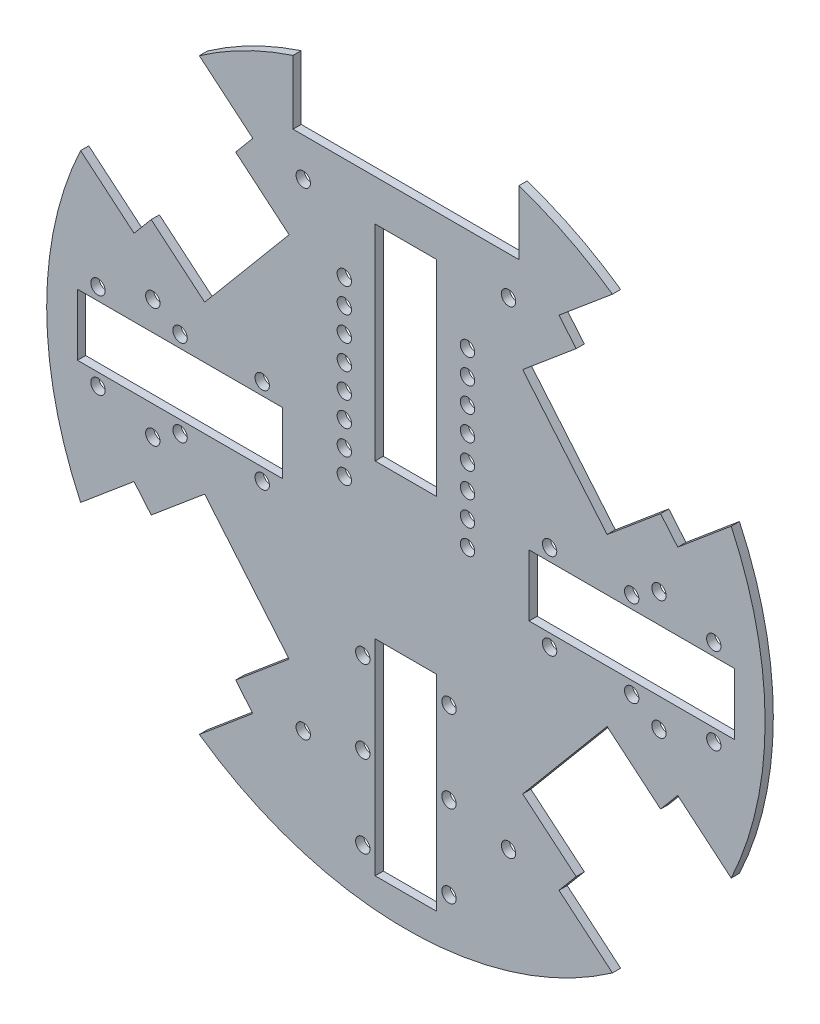
from build123d import *

# Parameters (mm, degrees)
SKETCH2_R                                  = 87.5
BOSS_EXTRUDE2_DEPTH                        = 2
SKETCH3_W                                  = 55
SKETCH3_H                                  = 40
CUT_EXTRUDE1_DEPTH                         = 124.759848093
CUT_EXTRUDE2_DEPTH                         = 124.759848093
SKETCH7_R                                  = 1.75
CUT_EXTRUDE3_DEPTH                         = 124.759848093
MIRROR1_AT_THE_SECOND_PLANE_COPY_1_DEPTH   = 124.759848093
MIRROR1_AT_THE_SECOND_PLANE_COPY_2_SKETC_R = 1.75
MIRROR1_AT_THE_SECOND_PLANE_COPY_2_DEPTH   = 124.759848093
SKETCH8_W                                  = 50
SKETCH8_H                                  = 15
CUT_EXTRUDE5_DEPTH                         = 124.759848093
SKETCH11_R                                 = 1.75
CUT_EXTRUDE7_DEPTH                         = 124.759848093
LPATTERN2_COUNT                            = 3
LPATTERN2_PITCH                            = 20
CIRPATTERN1_COUNT                          = 3
CIRPATTERN1_ANGLE                          = 180
CIRPATTERN1_COPY_1_SKETCH_R                = 1.75
CIRPATTERN1_COPY_1_DEPTH                   = 124.759848093
CIRPATTERN1_COPY_2_SKETCH_R                = 1.75
CIRPATTERN1_COPY_2_DEPTH                   = 124.759848093
CIRPATTERN1_COPY_3_SKETCH_R                = 1.75
CIRPATTERN1_COPY_3_DEPTH                   = 124.759848093
CIRPATTERN1_COPY_4_SKETCH_R                = 1.75
CIRPATTERN1_COPY_4_DEPTH                   = 124.759848093
SKETCH13_W                                 = 15
SKETCH13_H                                 = 50
CUT_EXTRUDE8_DEPTH                         = 124.759848093
SKETCH14_R                                 = 1.75
CUT_EXTRUDE9_DEPTH                         = 124.759848093


with BuildPart() as part:
    # Sketch2 → Boss-Extrude2 (new body)
    with BuildSketch(Plane.XY):
        Circle(SKETCH2_R)
    extrude(amount=BOSS_EXTRUDE2_DEPTH)

    # Sketch3 → Cut-Extrude1 (cut, through all)
    with BuildSketch(Plane.XY.offset(2)):
        with Locations((0, 87.5)):
            Rectangle(SKETCH3_W, SKETCH3_H)
    extrude(amount=-CUT_EXTRUDE1_DEPTH, mode=Mode.SUBTRACT)

    # Sketch6 → Cut-Extrude2 (cut, through all)
    with BuildSketch(Plane.XY.offset(2)):
        with BuildLine():
            Line((-79.237656457, 37.116624298), (-66.214900923, 26.189234933))
            Line((-66.214900923, 26.189234933), (-62.036781461, 31.168523814))
            Line((-62.036781461, 31.168523814), (-49.014025927, 20.241134449))
            Line((-49.014025927, 20.241134449), (-28.444822418, 44.754556629))
            Line((-28.444822418, 44.754556629), (-41.467577951, 55.681945993))
            Line((-41.467577951, 55.681945993), (-37.289458488, 60.661234874))
            Line((-37.289458488, 60.661234874), (-50.312214021, 71.588624238))
            ThreePointArc((-50.312214021, 71.588624238), (-67.028888773, 56.243915848), (-79.237656457, 37.116624298))
        make_face()
    cut_extrude2 = extrude(amount=-CUT_EXTRUDE2_DEPTH, mode=Mode.SUBTRACT)

    # Sketch7 → Cut-Extrude3 (cut, through all)
    with BuildSketch(Plane.XY.offset(2)):
        with Locations((-61.645137707, 14.522304568)):
            Circle(SKETCH7_R)
        with Locations((-25.006243955, 58.186837826)):
            Circle(SKETCH7_R)
    cut_extrude3 = extrude(amount=-CUT_EXTRUDE3_DEPTH, mode=Mode.SUBTRACT)

    # Mirror1: Cut-Extrude2, Cut-Extrude3 across plane
    add(cut_extrude2.mirror(Plane.ZX), mode=Mode.SUBTRACT)
    add(cut_extrude3.mirror(Plane.ZX), mode=Mode.SUBTRACT)

    # Mirror1 at the second plane: Cut-Extrude2, Cut-Extrude3 across plane
    add(cut_extrude2.mirror(Plane(origin=(0, 0, 0), x_dir=(0, 0, 1), z_dir=(1, 0, 0))), mode=Mode.SUBTRACT)
    add(cut_extrude3.mirror(Plane(origin=(0, 0, 0), x_dir=(0, 0, 1), z_dir=(1, 0, 0))), mode=Mode.SUBTRACT)

    # Mirror1 at the second plane copy 1 sketc → Mirror1 at the second plane copy 1 (cut, through all)
    with BuildSketch(Plane(origin=(0, 0, 2), x_dir=(-1, 0, 0), z_dir=(0, 0, 1))):
        with BuildLine():
            Line((-79.237656457, 37.116624298), (-66.214900923, 26.189234933))
            Line((-66.214900923, 26.189234933), (-62.036781461, 31.168523814))
            Line((-62.036781461, 31.168523814), (-49.014025927, 20.241134449))
            Line((-49.014025927, 20.241134449), (-28.444822418, 44.754556629))
            Line((-28.444822418, 44.754556629), (-41.467577951, 55.681945993))
            Line((-41.467577951, 55.681945993), (-37.289458488, 60.661234874))
            Line((-37.289458488, 60.661234874), (-50.312214021, 71.588624238))
            ThreePointArc((-50.312214021, 71.588624238), (-67.028888773, 56.243915848), (-79.237656457, 37.116624298))
        make_face()
    extrude(amount=-MIRROR1_AT_THE_SECOND_PLANE_COPY_1_DEPTH, mode=Mode.SUBTRACT)

    # Mirror1 at the second plane copy 2 sketc → Mirror1 at the second plane copy 2 (cut, through all)
    with BuildSketch(Plane(origin=(0, 0, 2), x_dir=(-1, 0, 0), z_dir=(0, 0, 1))):
        with Locations((-61.645137707, 14.522304568)):
            Circle(MIRROR1_AT_THE_SECOND_PLANE_COPY_2_SKETC_R)
        with Locations((-25.006243955, 58.186837826)):
            Circle(MIRROR1_AT_THE_SECOND_PLANE_COPY_2_SKETC_R)
    extrude(amount=-MIRROR1_AT_THE_SECOND_PLANE_COPY_2_DEPTH, mode=Mode.SUBTRACT)

    # Sketch8 → Cut-Extrude5 (cut, through all)
    with BuildSketch(Plane.XY.offset(2)):
        with Locations((-55, 0)):
            Rectangle(SKETCH8_W, SKETCH8_H)
    cut_extrude5 = extrude(amount=-CUT_EXTRUDE5_DEPTH, mode=Mode.SUBTRACT)

    # Sketch11 → Cut-Extrude7 (cut, through all)
    with BuildSketch(Plane.XY.offset(2)):
        with Locations((-35, 10.5)):
            Circle(SKETCH11_R)
        with Locations((-35, -10.5)):
            Circle(SKETCH11_R)
    cut_extrude7 = extrude(amount=-CUT_EXTRUDE7_DEPTH, mode=Mode.SUBTRACT)

    # LPattern2: Cut-Extrude7 ×3
    with Locations(*[(-i * LPATTERN2_PITCH, 0, 0) for i in range(1, LPATTERN2_COUNT)]):
        add(cut_extrude7, mode=Mode.SUBTRACT)

    # CirPattern1: Cut-Extrude5, Cut-Extrude7 ×3 about axis
    cirpattern1_axis = Axis((0, 0, 0), (0, 0, 1))
    add([cut_extrude5.rotate(cirpattern1_axis, i * CIRPATTERN1_ANGLE / (CIRPATTERN1_COUNT - 1)) for i in range(1, CIRPATTERN1_COUNT)], mode=Mode.SUBTRACT)
    add([cut_extrude7.rotate(cirpattern1_axis, i * CIRPATTERN1_ANGLE / (CIRPATTERN1_COUNT - 1)) for i in range(1, CIRPATTERN1_COUNT)], mode=Mode.SUBTRACT)

    # CirPattern1 copy 1 sketch → CirPattern1 copy 1 (cut, through all)
    with BuildSketch(Plane(origin=(0, -20, 2), x_dir=(0, 1, 0), z_dir=(0, 0, 1))):
        with Locations((-35, 10.5)):
            Circle(CIRPATTERN1_COPY_1_SKETCH_R)
        with Locations((-35, -10.5)):
            Circle(CIRPATTERN1_COPY_1_SKETCH_R)
    extrude(amount=-CIRPATTERN1_COPY_1_DEPTH, mode=Mode.SUBTRACT)

    # CirPattern1 copy 2 sketch → CirPattern1 copy 2 (cut, through all)
    with BuildSketch(Plane(origin=(20, 0, 2), x_dir=(-1, 0, 0), z_dir=(0, 0, 1))):
        with Locations((-35, 10.5)):
            Circle(CIRPATTERN1_COPY_2_SKETCH_R)
        with Locations((-35, -10.5)):
            Circle(CIRPATTERN1_COPY_2_SKETCH_R)
    extrude(amount=-CIRPATTERN1_COPY_2_DEPTH, mode=Mode.SUBTRACT)

    # CirPattern1 copy 3 sketch → CirPattern1 copy 3 (cut, through all)
    with BuildSketch(Plane(origin=(0, -40, 2), x_dir=(0, 1, 0), z_dir=(0, 0, 1))):
        with Locations((-35, 10.5)):
            Circle(CIRPATTERN1_COPY_3_SKETCH_R)
        with Locations((-35, -10.5)):
            Circle(CIRPATTERN1_COPY_3_SKETCH_R)
    extrude(amount=-CIRPATTERN1_COPY_3_DEPTH, mode=Mode.SUBTRACT)

    # CirPattern1 copy 4 sketch → CirPattern1 copy 4 (cut, through all)
    with BuildSketch(Plane(origin=(40, 0, 2), x_dir=(-1, 0, 0), z_dir=(0, 0, 1))):
        with Locations((-35, 10.5)):
            Circle(CIRPATTERN1_COPY_4_SKETCH_R)
        with Locations((-35, -10.5)):
            Circle(CIRPATTERN1_COPY_4_SKETCH_R)
    extrude(amount=-CIRPATTERN1_COPY_4_DEPTH, mode=Mode.SUBTRACT)

    # Sketch13 → Cut-Extrude8 (cut, through all)
    with BuildSketch(Plane.XY.offset(2)):
        with Locations((0, 32.5)):
            Rectangle(SKETCH13_W, SKETCH13_H)
    extrude(amount=-CUT_EXTRUDE8_DEPTH, mode=Mode.SUBTRACT)

    # Sketch14 → Cut-Extrude9 (cut, through all)
    with BuildSketch(Plane.XY.offset(2)):
        with Locations((-15, 42.5)):
            Circle(SKETCH14_R)
        with Locations((15, 42.5)):
            Circle(SKETCH14_R)
        with Locations((-15, 36.5)):
            Circle(SKETCH14_R)
        with Locations((15, 36.5)):
            Circle(SKETCH14_R)
        with Locations((-15, 30.5)):
            Circle(SKETCH14_R)
        with Locations((15, 30.5)):
            Circle(SKETCH14_R)
        with Locations((-15, 24.5)):
            Circle(SKETCH14_R)
        with Locations((15, 24.5)):
            Circle(SKETCH14_R)
        with Locations((-15, 18.5)):
            Circle(SKETCH14_R)
        with Locations((15, 18.5)):
            Circle(SKETCH14_R)
        with Locations((-15, 12.5)):
            Circle(SKETCH14_R)
        with Locations((15, 12.5)):
            Circle(SKETCH14_R)
        with Locations((-15, 6.5)):
            Circle(SKETCH14_R)
        with Locations((15, 6.5)):
            Circle(SKETCH14_R)
        with Locations((-15, 0.5)):
            Circle(SKETCH14_R)
        with Locations((15, 0.5)):
            Circle(SKETCH14_R)
    extrude(amount=-CUT_EXTRUDE9_DEPTH, mode=Mode.SUBTRACT)


solid = part.part
